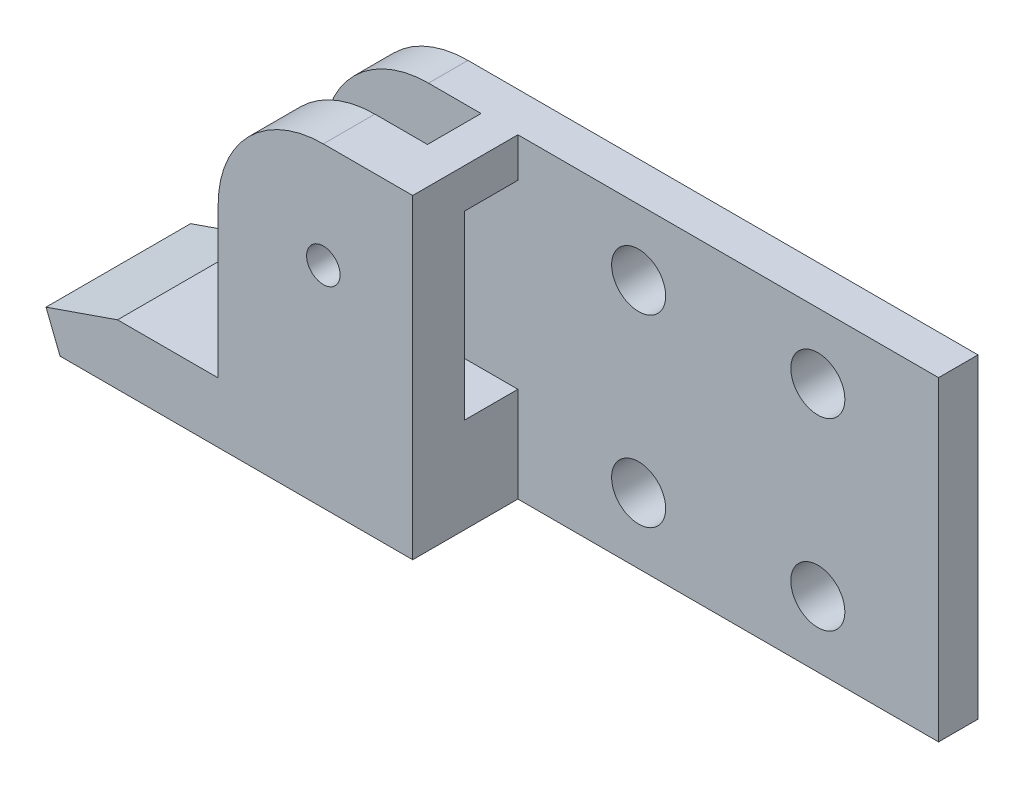
from build123d import *

# Parameters (mm, degrees)
SKETCH2_R                  = 3.175
BOSS_EXTRUDE1_DEPTH        = 4.7625
BOSS_EXTRUDE2_DEPTH        = 12.7
SKETCH12_W                 = 6.477
SKETCH12_H                 = 21.856650617
CUT_EXTRUDE1_DEPTH         = 24.13
SKETCH12_3_W               = 6.477
SKETCH12_3_H               = 4.7625
CUT_EXTRUDE2_DEPTH         = 19.05
TAP_DRILL_FOR_10_32_TAP1_D = 4.0386
F_1_4_CLEARANCE_HOLE1_D    = 6.5278


with BuildPart() as part:
    # Sketch2 → Boss-Extrude1 (new body)
    with BuildSketch(Plane.XY):
        with BuildLine():
            Line((-67.986186343, -228.533359856), (-69.686856366, -224.252380141))
            Line((-69.686856366, -224.252380141), (-61.0470258, -221.260552334))
            Line((-61.0470258, -221.260552334), (-48.895, -221.260552334))
            Line((-48.895, -221.260552334), (-48.895, -203.133359856))
            ThreePointArc((-48.895, -203.133359856), (-45.175256121, -194.153103735), (-36.195, -190.433359856))
            Line((-36.195, -190.433359856), (25.4, -190.433359856))
            Line((25.4, -190.433359856), (25.4, -228.533359856))
            Line((25.4, -228.533359856), (-67.986186343, -228.533359856))
        make_face()
        with Locations((-36.195, -203.133359856)):
            Circle(SKETCH2_R, mode=Mode.SUBTRACT)
    extrude(amount=BOSS_EXTRUDE1_DEPTH)

    # Sketch11 → Boss-Extrude2 (add)
    with BuildSketch(Plane(origin=(0, 0, 4.7625), x_dir=(-1, 0, 0), z_dir=(0, 0, -1))):
        with BuildLine():
            Line((25.4, -190.433359856), (25.4, -228.533359856))
            Line((25.4, -228.533359856), (67.986186343, -228.533359856))
            Line((67.986186343, -228.533359856), (69.686856366, -224.252380141))
            Line((69.686856366, -224.252380141), (61.0470258, -221.260552334))
            Line((61.0470258, -221.260552334), (48.895, -221.260552334))
            Line((48.895, -221.260552334), (48.895, -203.133359856))
            ThreePointArc((48.895, -203.133359856), (45.175256121, -194.153103735), (36.195, -190.433359856))
            Line((36.195, -190.433359856), (25.4, -190.433359856))
        make_face()
    extrude(amount=-BOSS_EXTRUDE2_DEPTH)

    # Sketch12 → Cut-Extrude1 (cut)
    with BuildSketch(Plane.ZY.offset(48.895)):
        with Locations((8.001, -206.124185165)):
            Rectangle(SKETCH12_W, SKETCH12_H)
    extrude(amount=-CUT_EXTRUDE1_DEPTH, mode=Mode.SUBTRACT)

    # Sketch12<3> → Cut-Extrude2 (cut)
    with BuildSketch(Plane.ZY.offset(48.895)):
        with Locations((8.001, -192.814609856)):
            Rectangle(SKETCH12_3_W, SKETCH12_3_H)
    extrude(amount=-CUT_EXTRUDE2_DEPTH, mode=Mode.SUBTRACT)

    # Tap Drill for #10-32 Tap1 (through all)
    with Locations(Plane(origin=(0, 0, 11.2395), x_dir=(1, 0, 0), z_dir=(0, 0, -1))):
        with Locations((-36.195, 203.133359856)):
            Hole(TAP_DRILL_FOR_10_32_TAP1_D / 2)

    # 1/4 Clearance Hole1 (through all)
    with Locations(Plane.XY.offset(4.7625)):
        with Locations((-10.8204, -198.370859856), (-10.8204, -220.595859856), (10.8204, -220.595859856), (10.8204, -198.370859856)):
            Hole(F_1_4_CLEARANCE_HOLE1_D / 2)


solid = part.part
